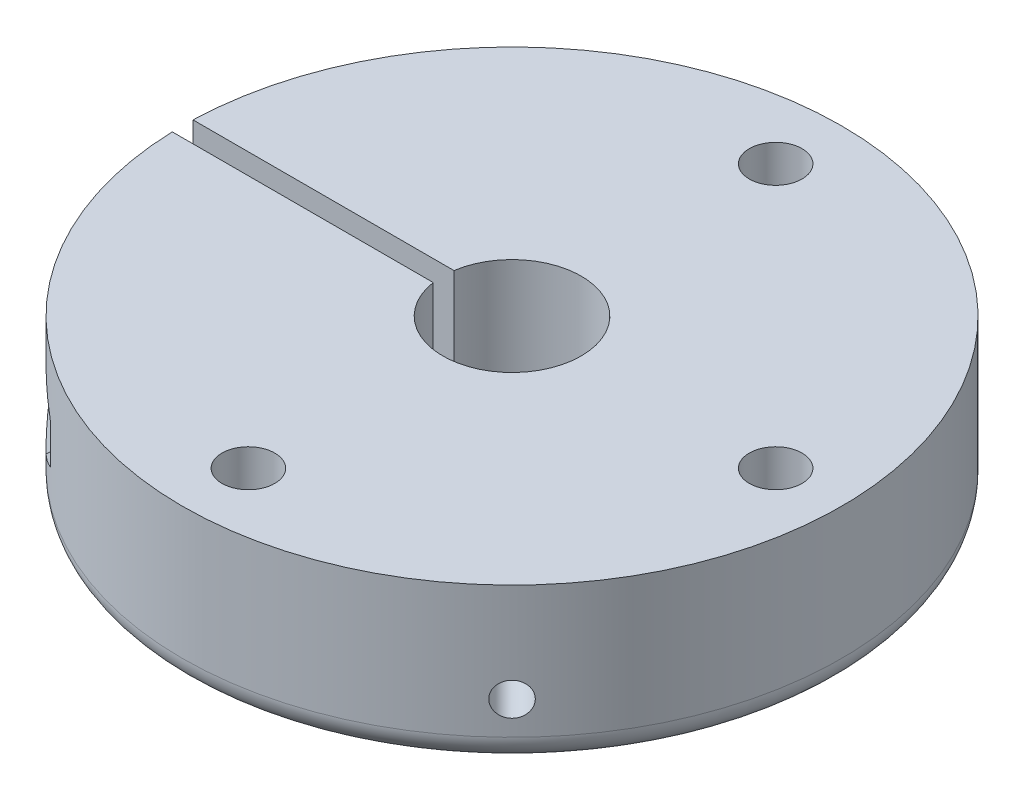
from build123d import *

# Parameters (mm, degrees)
SKETCH1_R               = 2
BOSS_EXTRUDE1_DEPTH     = 12
CUT_EXTRUDE1_REACH      = 63.528
CUT_EXTRUDE1_END_RADIUS = 5.25
SKETCH2_R               = 1.25
CUT_EXTRUDE2_REACH      = 45.868
CUT_EXTRUDE2_END_RADIUS = 25
CUT_EXTRUDE2_START      = -6
SKETCH3_R               = 3
CUT_EXTRUDE3_DEPTH      = 38.868128668
CUT_EXTRUDE3_DEPTH_BACK = 38.868128668
SKETCH3_4_R             = 1.5
CUT_EXTRUDE4_REACH      = 50.868
CUT_EXTRUDE4_END_RADIUS = 25
CUT_EXTRUDE4_START      = 11
FILLET1_R               = 2


with BuildPart() as part:
    # Sketch1 → Boss-Extrude1 (new body)
    with BuildSketch(Plane(origin=(0, 0, 0), x_dir=(1, 0, 0), z_dir=(0, 1, 0))):
        with BuildLine():
            ThreePointArc((-24.987593797, -0.7875), (25, 0), (-24.987593797, 0.7875))
            Line((-24.987593797, 0.7875), (-5.190601482, 0.7875))
            ThreePointArc((-5.190601482, 0.7875), (5.25, 0), (-5.190601482, -0.7875))
            Line((-5.190601482, -0.7875), (-24.987593797, -0.7875))
        make_face()
        with Locations(Location((0, 20, 0), (0, 0, 270))):
            Circle(SKETCH1_R, mode=Mode.SUBTRACT)
        with Locations(Location((20, 0, 0), (0, 0, 270))):
            Circle(SKETCH1_R, mode=Mode.SUBTRACT)
        with Locations(Location((0, -20, 0), (0, 0, 270))):
            Circle(SKETCH1_R, mode=Mode.SUBTRACT)
    extrude(amount=BOSS_EXTRUDE1_DEPTH)

    # Cut-Extrude1: up to this cylinder (the profile starts outside it)
    cut_extrude1_end = Plane(origin=(0, 4.5, 0), z_dir=(0, -1, 0)) * Cylinder(CUT_EXTRUDE1_END_RADIUS, 138.556, mode=Mode.PRIVATE)
    # Sketch2 → Cut-Extrude1 (cut, up to the surface)
    with BuildSketch(Plane(origin=(17.67766953, 0, 17.67766953), x_dir=(0, -1, 0), z_dir=(0.7071067811865464, 0, 0.7071067811865488)), mode=Mode.PRIVATE) as cut_extrude1_sk1:
        with Locations(Location((-4.5, 0, 0), (0, 0, 90))):
            Circle(SKETCH2_R)
    cut_extrude1_tool1 = extrude(cut_extrude1_sk1.sketch, amount=-CUT_EXTRUDE1_REACH, mode=Mode.PRIVATE) - cut_extrude1_end
    add(cut_extrude1_tool1.solids().sort_by_distance((17.67767, 4.5, 17.67767))[0], mode=Mode.SUBTRACT)

    # Cut-Extrude2: up to this cylinder (the profile starts inside it)
    cut_extrude2_end = Plane(origin=(0, 6, 0), z_dir=(0, -1, 0)) * Cylinder(CUT_EXTRUDE2_END_RADIUS, 142.736, mode=Mode.PRIVATE)
    # Sketch3 → Cut-Extrude2 (cut, up to the surface)
    with BuildSketch(Plane.XY.offset(-0.7875).offset(CUT_EXTRUDE2_START), mode=Mode.PRIVATE) as cut_extrude2_sk1:
        with Locations((-17.487593797, 6)):
            Circle(SKETCH3_R)
    cut_extrude2_tool1 = extrude(cut_extrude2_sk1.sketch, amount=-CUT_EXTRUDE2_REACH, mode=Mode.PRIVATE) & cut_extrude2_end
    add(cut_extrude2_tool1.solids().sort_by_distance((-17.487594, 6, -6.7875))[0], mode=Mode.SUBTRACT)

    # Sketch3<4> → Cut-Extrude3 (cut, two sides: drawn at the far end of the back side and taken through both)
    with BuildSketch(Plane.XY.offset(-0.7875).offset(-CUT_EXTRUDE3_DEPTH_BACK)):
        with Locations((-17.487593797, 6)):
            Circle(SKETCH3_4_R)
    extrude(amount=CUT_EXTRUDE3_DEPTH + CUT_EXTRUDE3_DEPTH_BACK, mode=Mode.SUBTRACT)

    # Cut-Extrude4: up to this cylinder (the profile starts inside it)
    cut_extrude4_end = Plane(origin=(0, 6, 0), z_dir=(0, -1, 0)) * Cylinder(CUT_EXTRUDE4_END_RADIUS, 152.736, mode=Mode.PRIVATE)
    # Sketch5 → Cut-Extrude4 (cut, up to the surface)
    with BuildSketch(Plane.XY.offset(-0.7875).offset(CUT_EXTRUDE4_START), mode=Mode.PRIVATE) as cut_extrude4_sk1:
        Polygon((-14.987593797, 7.443375673), (-17.487593797, 8.886751346), (-19.987593797, 7.443375673), (-19.987593797, 4.556624327), (-17.487593797, 3.113248654), (-14.987593797, 4.556624327), align=None)
    cut_extrude4_tool1 = extrude(cut_extrude4_sk1.sketch, amount=CUT_EXTRUDE4_REACH, mode=Mode.PRIVATE) & cut_extrude4_end
    add(cut_extrude4_tool1.solids().sort_by_distance((-17.487594, 6, 10.2125))[0], mode=Mode.SUBTRACT)

    # Fillet1
    fillet1_edges = [part.edges().sort_by_distance(p)[0] for p in [
        (25, 0, 0),
    ]]
    fillet(fillet1_edges, radius=FILLET1_R)


solid = part.part
